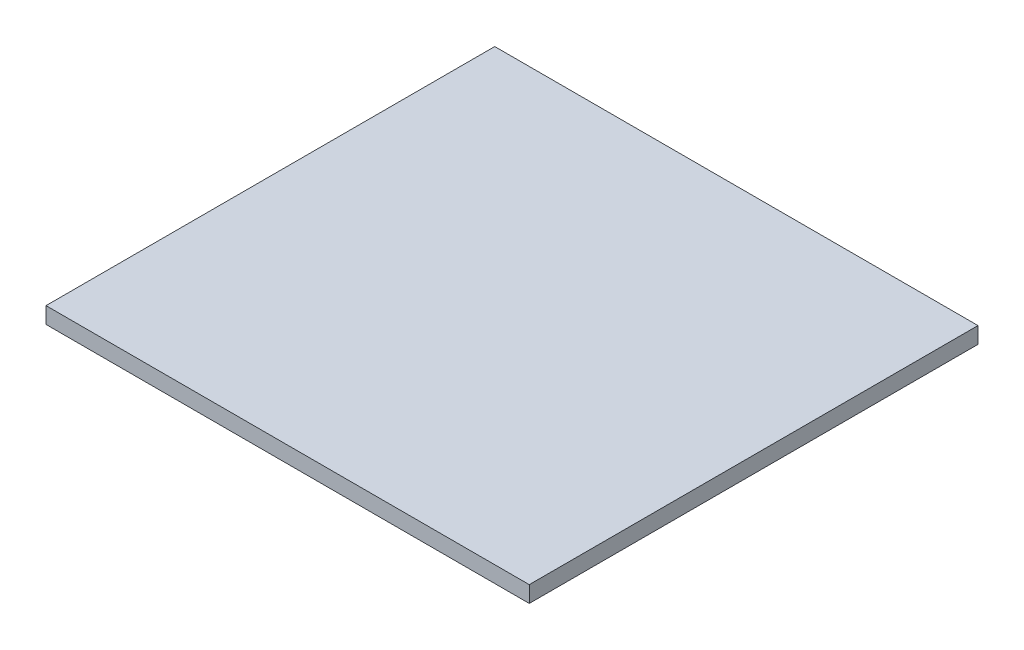
from build123d import *

# Parameters (mm, degrees)
SKETCH1_W           = 177.8
SKETCH1_H           = 165.1
BOSS_EXTRUDE1_DEPTH = 6


with BuildPart() as part:
    # Sketch1 → Boss-Extrude1 (new body)
    with BuildSketch(Plane(origin=(0, 0, 0), x_dir=(1, 0, 0), z_dir=(0, 1, 0))):
        Rectangle(SKETCH1_W, SKETCH1_H)
    extrude(amount=BOSS_EXTRUDE1_DEPTH)


solid = part.part
